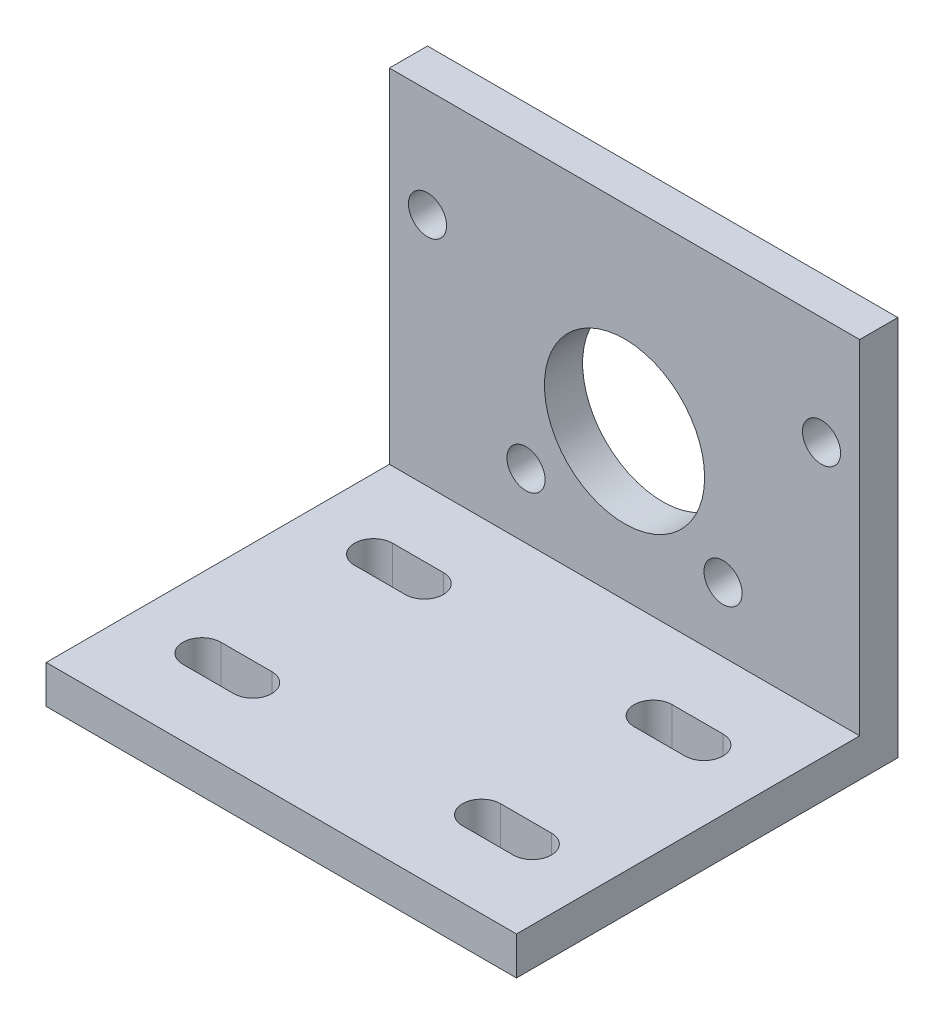
from build123d import *

# Parameters (mm, degrees)
SKETCH1_W                = 37
SKETCH1_H                = 27
SKETCH1_R                = 1.5
SKETCH1_R_2              = 6.3
BOSS_EXTRUDE2_DEPTH      = 3
BOSS_EXTRUDE4_DEPTH      = 27
BOSS_EXTRUDE4_DEPTH_BACK = 3
SKETCH2_W                = 37
SKETCH2_H                = 3
CUT_EXTRUDE1_DEPTH       = 55.753995288
CROQUIS1_W               = 9.332939374
CROQUIS1_H               = 27
SALIENTE_EXTRUIR1_DEPTH  = 10
CROQUIS2_W               = 9.332939374
CROQUIS2_H               = 27
CORTAR_EXTRUIR1_DEPTH    = 10
CROQUIS3_W               = 10.381853436
CROQUIS3_H               = 27
SALIENTE_EXTRUIR2_DEPTH  = 10
CROQUIS4_W               = 10.381853436
CROQUIS4_H               = 27
CORTAR_EXTRUIR3_DEPTH    = 10
CROQUIS5_W               = 9.124203914
CROQUIS5_H               = 27
SALIENTE_EXTRUIR3_DEPTH  = 10
CROQUIS6_W               = 9.124203914
CROQUIS6_H               = 27
CORTAR_EXTRUIR5_DEPTH    = 10


with BuildPart() as part:
    # Sketch1 → Boss-Extrude2 (new body)
    with BuildSketch(Plane.XY):
        with Locations((18.5, 16.5)):
            Rectangle(SKETCH1_W, SKETCH1_H)
        with Locations((10.75, 8.076606241)):
            Circle(SKETCH1_R, mode=Mode.SUBTRACT)
        with Locations((18.5, 14.5)):
            Circle(SKETCH1_R_2, mode=Mode.SUBTRACT)
        with Locations((26.25, 8.076606241)):
            Circle(SKETCH1_R, mode=Mode.SUBTRACT)
        with Locations((3, 21.5)):
            Circle(SKETCH1_R, mode=Mode.SUBTRACT)
        with Locations((34, 21.5)):
            Circle(SKETCH1_R, mode=Mode.SUBTRACT)
    extrude(amount=BOSS_EXTRUDE2_DEPTH)

    # Sketch2 → Boss-Extrude4 (add, two sides: drawn at the far end of the back side and taken through both)
    with BuildSketch(Plane.XY.offset(3).offset(-BOSS_EXTRUDE4_DEPTH_BACK)):
        with Locations((18.5, 1.5)):
            Rectangle(SKETCH2_W, SKETCH2_H)
    extrude(amount=BOSS_EXTRUDE4_DEPTH + BOSS_EXTRUDE4_DEPTH_BACK)

    # Sketch4 → Cut-Extrude1 (cut, through all)
    with BuildSketch(Plane(origin=(0, 3, 0), x_dir=(1, 0, 0), z_dir=(0, 1, 0))):
        with BuildLine():
            Line((5.5, -8.25), (9.5, -8.25))
            ThreePointArc((9.5, -8.25), (11, -9.75), (9.5, -11.25))
            Line((9.5, -11.25), (5.5, -11.25))
            ThreePointArc((5.5, -11.25), (4, -9.75), (5.5, -8.25))
        make_face()
        with BuildLine():
            Line((27.5, -8.25), (31.5, -8.25))
            ThreePointArc((31.5, -8.25), (33, -9.75), (31.5, -11.25))
            Line((31.5, -11.25), (27.5, -11.25))
            ThreePointArc((27.5, -11.25), (26, -9.75), (27.5, -8.25))
        make_face()
        with BuildLine():
            Line((27.5, -21.75), (31.5, -21.75))
            ThreePointArc((31.5, -21.75), (33, -23.25), (31.5, -24.75))
            Line((31.5, -24.75), (27.5, -24.75))
            ThreePointArc((27.5, -24.75), (26, -23.25), (27.5, -21.75))
        make_face()
        with BuildLine():
            Line((5.5, -21.75), (9.5, -21.75))
            ThreePointArc((9.5, -21.75), (11, -23.25), (9.5, -24.75))
            Line((9.5, -24.75), (5.5, -24.75))
            ThreePointArc((5.5, -24.75), (4, -23.25), (5.5, -21.75))
        make_face()
    extrude(amount=-CUT_EXTRUDE1_DEPTH, mode=Mode.SUBTRACT)

    # Croquis1 → Saliente-Extruir1 (add)
    with BuildSketch(Plane(origin=(0, 3, 0), x_dir=(1, 0, 0), z_dir=(0, 1, 0))):
        with Locations((26.333530313, -16.5)):
            Rectangle(CROQUIS1_W, CROQUIS1_H)
    extrude(amount=SALIENTE_EXTRUIR1_DEPTH)

    # Croquis2 → Cortar-Extruir1 (cut)
    with BuildSketch(Plane(origin=(0, 3, 0), x_dir=(1, 0, 0), z_dir=(0, 1, 0))):
        with Locations((26.333530313, -16.5)):
            Rectangle(CROQUIS2_W, CROQUIS2_H)
    extrude(amount=CORTAR_EXTRUIR1_DEPTH, mode=Mode.SUBTRACT)

    # Croquis3 → Saliente-Extruir2 (add)
    with BuildSketch(Plane(origin=(0, 3, 0), x_dir=(1, 0, 0), z_dir=(0, 1, 0))):
        with Locations((25.809073282, -16.5)):
            Rectangle(CROQUIS3_W, CROQUIS3_H)
    extrude(amount=SALIENTE_EXTRUIR2_DEPTH)

    # Croquis4 → Cortar-Extruir3 (cut)
    with BuildSketch(Plane(origin=(0, 3, 0), x_dir=(1, 0, 0), z_dir=(0, 1, 0))):
        with Locations((25.809073282, -16.5)):
            Rectangle(CROQUIS4_W, CROQUIS4_H)
    extrude(amount=CORTAR_EXTRUIR3_DEPTH, mode=Mode.SUBTRACT)

    # Croquis5 → Saliente-Extruir3 (add)
    with BuildSketch(Plane(origin=(0, 3, 0), x_dir=(1, 0, 0), z_dir=(0, 1, 0))):
        with Locations((26.437898043, -16.5)):
            Rectangle(CROQUIS5_W, CROQUIS5_H)
    extrude(amount=SALIENTE_EXTRUIR3_DEPTH)

    # Croquis6 → Cortar-Extruir5 (cut)
    with BuildSketch(Plane(origin=(0, 3, 0), x_dir=(1, 0, 0), z_dir=(0, 1, 0))):
        with Locations((26.437898043, -16.5)):
            Rectangle(CROQUIS6_W, CROQUIS6_H)
    extrude(amount=CORTAR_EXTRUIR5_DEPTH, mode=Mode.SUBTRACT)


solid = part.part
